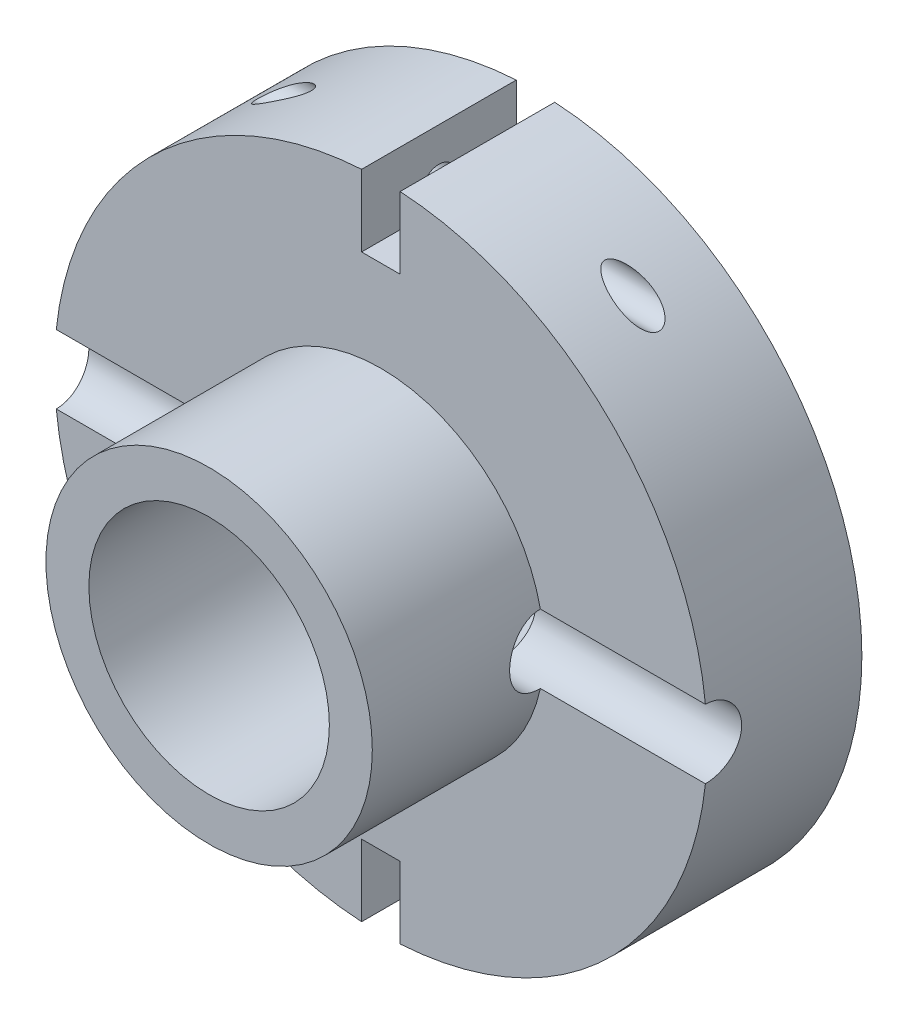
from build123d import *

# Parameters (mm, degrees)
ESQUISSE1_R                  = 67.85
ESQUISSE1_R_2                = 50
BOSS_EXTRU_1_DEPTH           = 71.4
ESQUISSE3_R                  = 135.7
ESQUISSE3_R_2                = 50
BOSS_EXTRU_2_DEPTH           = 64.3
ENL_V_MAT_EXTRU_1_DEPTH      = 236.039294587
ENL_V_MAT_EXTRU_1_DEPTH_BACK = 236.039294587
ESQUISSE4_R                  = 14.3
ENL_V_MAT_EXTRU_2_DEPTH      = 236.03929476
ENL_V_MAT_EXTRU_3_DEPTH      = 235.903107858
ENL_V_MAT_EXTRU_3_DEPTH_BACK = 235.903107858
ESQUISSE7_R                  = 7.15


with BuildPart() as part:
    # Esquisse1 → Boss.-Extru.1 (new body)
    with BuildSketch(Plane.XY):
        Circle(ESQUISSE1_R)
        Circle(ESQUISSE1_R_2, mode=Mode.SUBTRACT)
    extrude(amount=-BOSS_EXTRU_1_DEPTH)

    # Esquisse3 → Boss.-Extru.2 (add)
    with BuildSketch(Plane(origin=(0, 0, -71.4), x_dir=(-1, 0, 0), z_dir=(0, 0, -1))):
        Circle(ESQUISSE3_R)
        with Locations(Location((0, 0, 0), (0, 0, 180))):
            Circle(ESQUISSE3_R_2, mode=Mode.SUBTRACT)
    extrude(amount=BOSS_EXTRU_2_DEPTH)

    # Esquisse4 → Enlèv. mat.-Extru.1 (cut, two sides: drawn at the far end of the back side and taken through both)
    with BuildSketch(Plane(origin=(0, 0, 0), x_dir=(0, 0, -1), z_dir=(1, 0, 0)).offset(-ENL_V_MAT_EXTRU_1_DEPTH_BACK)):
        with Locations(Location((71.4, 0, 0), (0, 0, 180))):
            Circle(ESQUISSE4_R)
    extrude(amount=ENL_V_MAT_EXTRU_1_DEPTH + ENL_V_MAT_EXTRU_1_DEPTH_BACK, mode=Mode.SUBTRACT)

    # Esquisse6 → Enlèv. mat.-Extru.2 (cut, through all)
    with BuildSketch(Plane(origin=(0, 0, -135.7), x_dir=(-1, 0, 0), z_dir=(0, 0, -1))):
        with BuildLine():
            Line((-8, 105.7), (8, 105.7))
            Line((8, 105.7), (8, 135.463980452))
            ThreePointArc((8, 135.463980452), (0, 135.7), (-8, 135.463980452))
            Line((-8, 135.463980452), (-8, 105.7))
        make_face()
        with BuildLine():
            Line((8, -105.7), (8, -135.463980452))
            ThreePointArc((8, -135.463980452), (0, -135.7), (-8, -135.463980452))
            Line((-8, -135.463980452), (-8, -105.7))
            Line((-8, -105.7), (8, -105.7))
        make_face()
    extrude(amount=-ENL_V_MAT_EXTRU_2_DEPTH, mode=Mode.SUBTRACT)

    # Esquisse7 → Enlèv. mat.-Extru.3 (cut, two sides: drawn at the far end of the back side and taken through both)
    with BuildSketch(Plane(origin=(0, 0, 0), x_dir=(0, 0, -1), z_dir=(1, 0, 0)).offset(-ENL_V_MAT_EXTRU_3_DEPTH_BACK)):
        with Locations((103.55, 114.063980452)):
            Circle(ESQUISSE7_R)
        with Locations((103.55, -114.063980452)):
            Circle(ESQUISSE7_R)
    extrude(amount=ENL_V_MAT_EXTRU_3_DEPTH + ENL_V_MAT_EXTRU_3_DEPTH_BACK, mode=Mode.SUBTRACT)


solid = part.part
